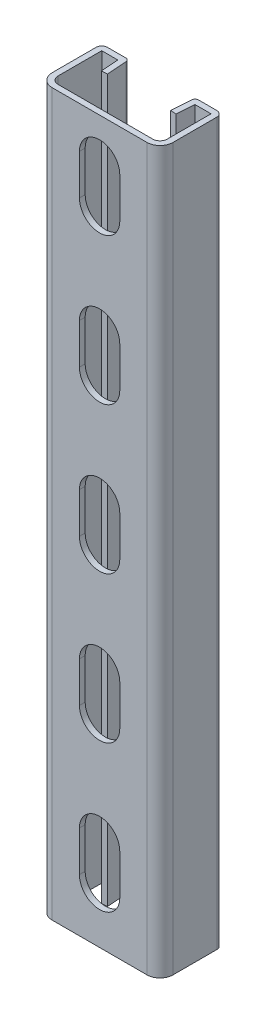
from build123d import *

# Parameters (mm, degrees)
BEAM_DEPTH          = 250
PUNCH_DEPTH         = 252.110782325
PATTERN_PUNCH_COUNT = 5
PATTERN_PUNCH_PITCH = 50.8


with BuildPart() as part:
    # sk_profile → beam (new body)
    with BuildSketch(Plane(origin=(0, 0, 0), x_dir=(1, 0, 0), z_dir=(0, 1, 0))):
        with BuildLine():
            Line((0, -10.85), (16.45, -10.85))
            ThreePointArc((16.45, -10.85), (19.631980515, -9.531980515), (20.95, -6.35))
            Line((20.95, -6.35), (20.95, 8.85))
            ThreePointArc((20.95, 8.85), (20.364213562, 10.264213562), (18.95, 10.85))
            Line((18.95, 10.85), (12.628432599, 10.85))
            ThreePointArc((12.628432599, 10.85), (11.810034567, 10.527624442), (11.431355739, 9.733707768))
            Line((11.431355739, 9.733707768), (10.95, 2.85))
            Line((10.95, 2.85), (12.945128101, 2.710487053))
            Line((12.945128101, 2.710487053), (13.374444668, 8.85))
            Line((13.374444668, 8.85), (18.95, 8.85))
            Line((18.95, 8.85), (18.95, -6.35))
            ThreePointArc((18.95, -6.35), (18.217766953, -8.117766953), (16.45, -8.85))
            Line((16.45, -8.85), (0, -8.85))
            Line((0, -8.85), (0, -10.85))
        make_face()
    beam = extrude(amount=BEAM_DEPTH)

    # mirror_half: beam across plane
    add(beam.mirror(Plane(origin=(0, 0, 0), x_dir=(0, 0, 1), z_dir=(1, 0, 0))))

    # Sketch4 → punch (cut, through all)
    with BuildSketch(Plane.XY):
        with BuildLine():
            Line((-7, 18.4), (-7, 32.4))
            ThreePointArc((-7, 32.4), (0, 39.4), (7, 32.4))
            Line((7, 32.4), (7, 18.4))
            ThreePointArc((7, 18.4), (0, 11.4), (-7, 18.4))
        make_face()
    punch = extrude(amount=PUNCH_DEPTH, mode=Mode.SUBTRACT)

    # pattern_punch: punch ×5
    with Locations(*[(0, i * PATTERN_PUNCH_PITCH, 0) for i in range(1, PATTERN_PUNCH_COUNT)]):
        add(punch, mode=Mode.SUBTRACT)


solid = part.part
